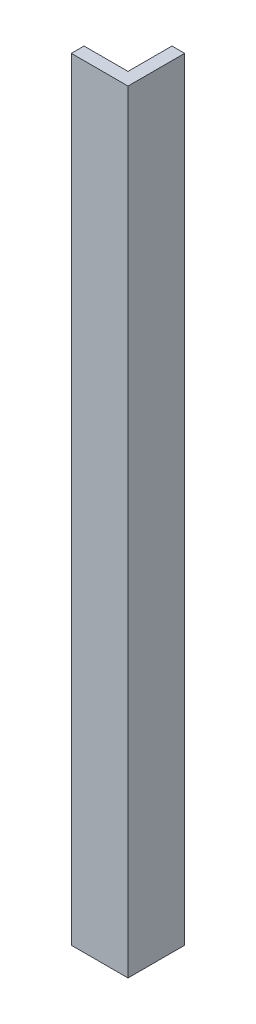
from build123d import *

# Parameters (mm, degrees)
BOSS_EXTRUDE1_DEPTH = 193.175


with BuildPart() as part:
    # Sketch1 → Boss-Extrude1 (new body)
    with BuildSketch(Plane(origin=(0, 0, 0), x_dir=(1, 0, 0), z_dir=(0, 1, 0))):
        Polygon((-3.175, 3.175), (-14.175, 3.175), (-14.175, 0), (0, 0), (0, 14.175), (-3.175, 14.175), align=None)
    extrude(amount=BOSS_EXTRUDE1_DEPTH)


solid = part.part
